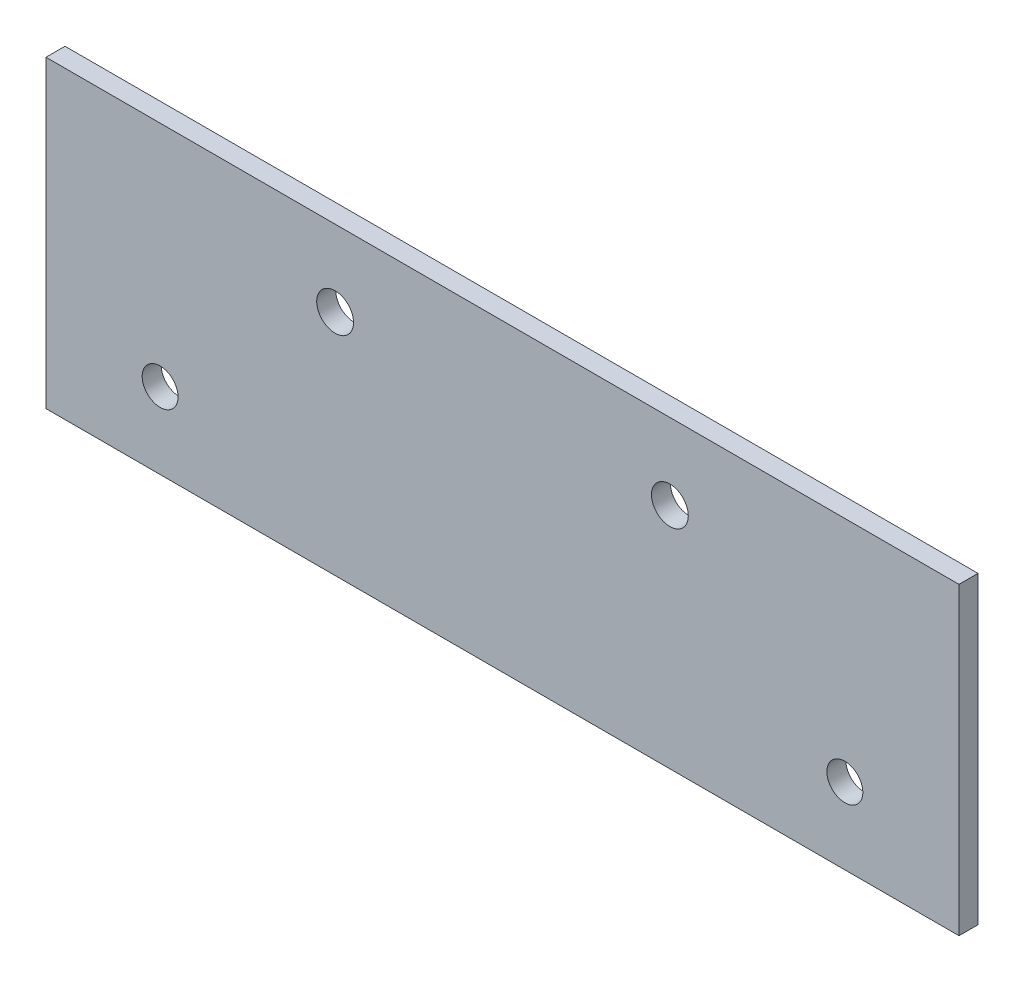
from build123d import *

# Parameters (mm, degrees)
SKETCH1_W           = 152.4
SKETCH1_H           = 50.8
SKETCH1_R           = 3.0734
SKETCH1_R_2         = 3
BOSS_EXTRUDE1_DEPTH = 3.175


with BuildPart() as part:
    # Sketch1 → Boss-Extrude1 (new body)
    with BuildSketch(Plane.XY):
        with Locations((0, 12.7)):
            Rectangle(SKETCH1_W, SKETCH1_H)
        with Locations((-27.94, 25.4)):
            Circle(SKETCH1_R, mode=Mode.SUBTRACT)
        with Locations((27.94, 25.4)):
            Circle(SKETCH1_R, mode=Mode.SUBTRACT)
        with Locations((-57.15, 0)):
            Circle(SKETCH1_R_2, mode=Mode.SUBTRACT)
        with Locations((57.15, 0)):
            Circle(SKETCH1_R_2, mode=Mode.SUBTRACT)
    extrude(amount=BOSS_EXTRUDE1_DEPTH)


solid = part.part
